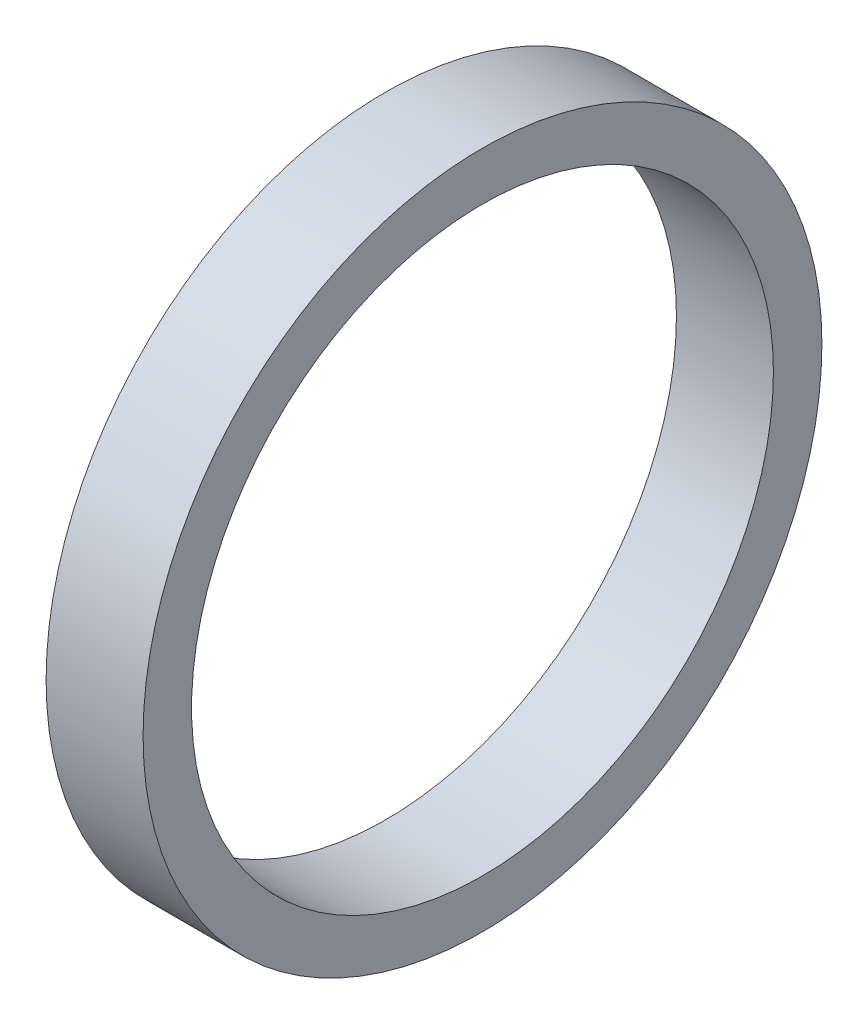
from build123d import *

# Parameters (mm, degrees)
SKETCH_1_R      = 3.5
SKETCH_1_R_2    = 3
EXTRUDE_1_DEPTH = 1


with BuildPart() as part:
    # 草图1 → 凸台-拉伸1 (new body)
    with BuildSketch(Plane(origin=(0, 0, 0), x_dir=(0, 0, -1), z_dir=(1, 0, 0))):
        Circle(SKETCH_1_R)
        Circle(SKETCH_1_R_2, mode=Mode.SUBTRACT)
    extrude(amount=EXTRUDE_1_DEPTH)


solid = part.part
